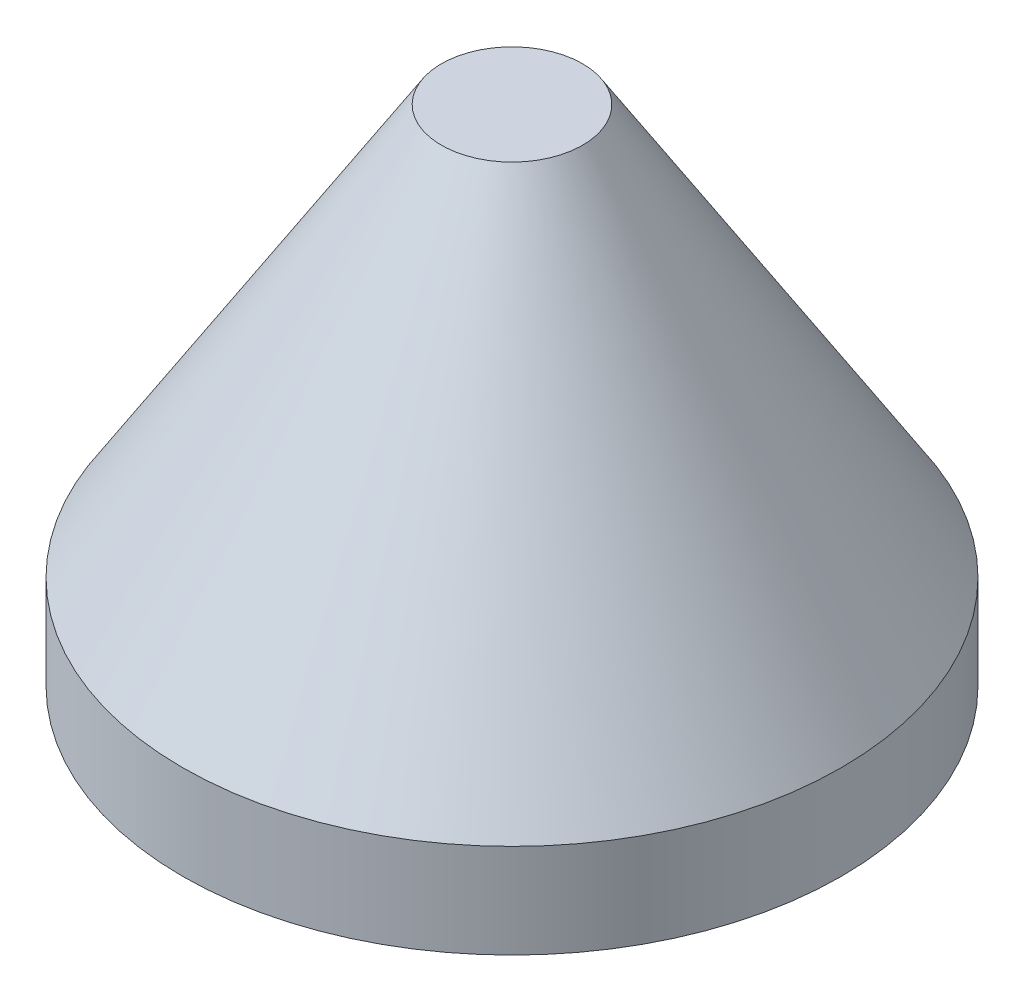
from build123d import *

# Parameters (mm, degrees)
SKETCH_1_R      = 14
EXTRUDE_1_DEPTH = 21.4


with BuildPart() as part:
    # 草图1 → 凸台-拉伸1 (new body)
    with BuildSketch(Plane(origin=(0, 0, 0), x_dir=(1, 0, 0), z_dir=(0, 1, 0))):
        with Locations(Location((0, 0, 0), (0, 0, 270))):
            Circle(SKETCH_1_R)
    extrude(amount=EXTRUDE_1_DEPTH)

    # 草图2 → 切除-旋转1 (revolve, cut)
    with BuildSketch(Plane.XY, mode=Mode.PRIVATE) as cut_revolve_1_sk:
        Polygon((3, 21.4), (14, 21.4), (14, 4), align=None)
    revolve(cut_revolve_1_sk.sketch.rotate(Axis((0, 0, 0), (0, 1, 0)), 90), axis=Axis((0, 0, 0), (0, 1, 0)), mode=Mode.SUBTRACT)


solid = part.part
